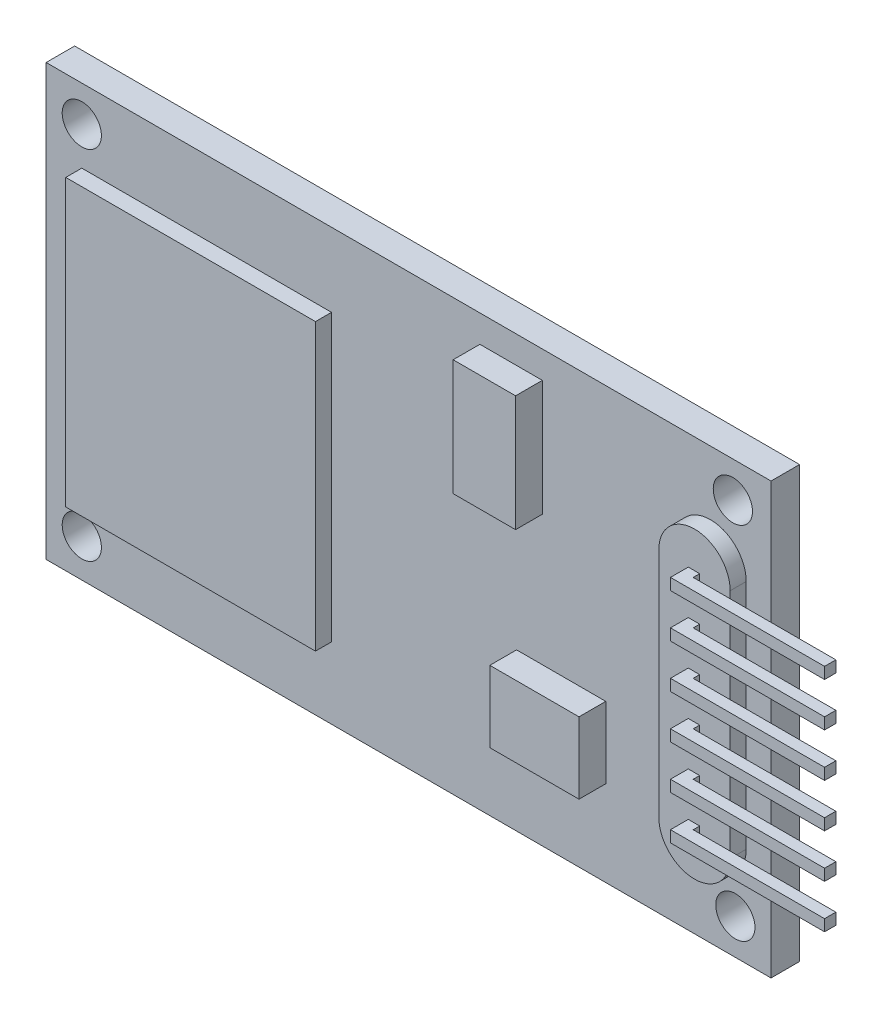
from build123d import *

# Parameters (mm, degrees)
SKETCH1_W           = 40.64
SKETCH1_H           = 24.13
BOSS_EXTRUDE1_DEPTH = 1.6
SKETCH2_W           = 13.99999994
SKETCH2_H           = 16
BOSS_EXTRUDE2_DEPTH = 2.5
SKETCH3_R           = 1.1
CUT_EXTRUDE1_DEPTH  = 2.5
LPATTERN1_COUNT     = 2
LPATTERN1_PITCH     = 36.5
LPATTERN2_COUNT     = 2
LPATTERN2_PITCH     = 20
SKETCH4_R           = 1.1
CUT_EXTRUDE2_DEPTH  = 2.5
BOSS_EXTRUDE3_DEPTH = 2.5
SKETCH6_W           = 0.64
SKETCH6_H           = 0.64
BOSS_EXTRUDE4_DEPTH = 1
SKETCH8_W           = 0.635
SKETCH8_H           = 0.64
BOSS_EXTRUDE5_DEPTH = 8
LPATTERN7_COUNT     = 6
LPATTERN7_PITCH     = 2.45
SKETCH9_W           = 3.5
SKETCH9_H           = 6.5
BOSS_EXTRUDE6_DEPTH = 1.5
SKETCH10_W          = 5
SKETCH10_H          = 4
BOSS_EXTRUDE7_DEPTH = 1.5


with BuildPart() as part:
    # Sketch1 → Boss-Extrude1 (new body)
    with BuildSketch(Plane.XY):
        with Locations((20.32, 12.065)):
            Rectangle(SKETCH1_W, SKETCH1_H)
    extrude(amount=BOSS_EXTRUDE1_DEPTH)

    # Sketch2 → Boss-Extrude2 (add)
    with BuildSketch(Plane.XY):
        with Locations((8.99999997, 12)):
            Rectangle(SKETCH2_W, SKETCH2_H)
    extrude(amount=BOSS_EXTRUDE2_DEPTH)

    # Sketch3 → Cut-Extrude1 (cut)
    with BuildSketch(Plane.XY):
        with Locations(Location((2, 22.129999936, 0), (0, 0, 180))):
            Circle(SKETCH3_R)
    cut_extrude1 = extrude(amount=CUT_EXTRUDE1_DEPTH, mode=Mode.SUBTRACT)

    # LPattern1: Cut-Extrude1 ×2
    with Locations(*[(i * LPATTERN1_PITCH, 0, 0) for i in range(1, LPATTERN1_COUNT)]):
        add(cut_extrude1, mode=Mode.SUBTRACT)

    # LPattern2: Cut-Extrude1 ×2
    with Locations(*[(0, -i * LPATTERN2_PITCH, 0) for i in range(1, LPATTERN2_COUNT)]):
        add(cut_extrude1, mode=Mode.SUBTRACT)

    # Sketch4 → Cut-Extrude2 (cut)
    with BuildSketch(Plane.XY.offset(1.6)):
        with Locations((38.64, 2.000000064)):
            Circle(SKETCH4_R)
    extrude(amount=-CUT_EXTRUDE2_DEPTH, mode=Mode.SUBTRACT)

    # Sketch5 → Boss-Extrude3 (add)
    with BuildSketch(Plane.XY):
        with BuildLine():
            Line((35.249253939, 18.555999972), (35.249253939, 5.556000064))
            ThreePointArc((35.249253939, 5.556000064), (37.249254003, 3.556), (39.249254067, 5.556000064))
            Line((39.249254067, 5.556000064), (39.249254067, 18.555999972))
            ThreePointArc((39.249254067, 18.555999972), (37.249254003, 20.556000036), (35.249253939, 18.555999972))
        make_face()
    extrude(amount=BOSS_EXTRUDE3_DEPTH)

    # Sketch6 → Boss-Extrude4 (add)
    with BuildSketch(Plane.XY.offset(2.5)):
        with Locations((37.220253939, 18.210599972)):
            Rectangle(SKETCH6_W, SKETCH6_H)
    boss_extrude4 = extrude(amount=BOSS_EXTRUDE4_DEPTH)

    # Sketch8 → Boss-Extrude5 (add)
    with BuildSketch(Plane(origin=(37.540253939, 0, 0), x_dir=(0, 0, -1), z_dir=(1, 0, 0))):
        with Locations((-3.1825, 18.210599972)):
            Rectangle(SKETCH8_W, SKETCH8_H)
    boss_extrude5 = extrude(amount=BOSS_EXTRUDE5_DEPTH)

    # LPattern7: Boss-Extrude4, Boss-Extrude5 ×6
    with Locations(*[(0, -i * LPATTERN7_PITCH, 0) for i in range(1, LPATTERN7_COUNT)]):
        add(boss_extrude4)
        add(boss_extrude5)

    # Sketch9 → Boss-Extrude6 (add)
    with BuildSketch(Plane.XY.offset(1.6)):
        with Locations((26.068319719, 19.356)):
            Rectangle(SKETCH9_W, SKETCH9_H)
    extrude(amount=BOSS_EXTRUDE6_DEPTH)

    # Sketch10 → Boss-Extrude7 (add)
    with BuildSketch(Plane.XY.offset(1.6)):
        with Locations((28.874727699, 6.798621882)):
            Rectangle(SKETCH10_W, SKETCH10_H)
    extrude(amount=BOSS_EXTRUDE7_DEPTH)


solid = part.part
